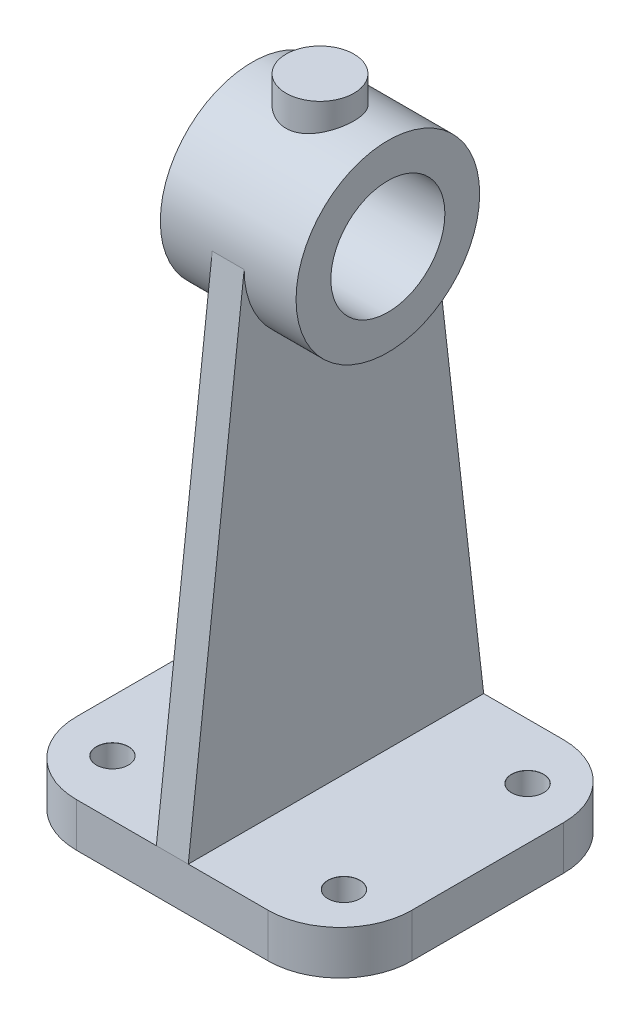
from build123d import *

# Parameters (mm, degrees)
SKETCH2_W                          = 84
SKETCH2_H                          = 74
BOSS_EXTRUDE1_DEPTH                = 11
FILLET1_R                          = 18
F_8_0_8_DIAMETER_HOLE1_D           = 8
F_8_0_8_DIAMETER_HOLE1_CSINK_D     = 8.05
F_8_0_8_DIAMETER_HOLE1_CSINK_ANGLE = 90
BOSS_EXTRUDE6_DEPTH                = 4
BOSS_EXTRUDE7_DEPTH                = 17
F_8_0_28_57_DIAMETER_HOLE1_D       = 28.57
BOSS_EXTRUDE8_REACH                = 173.397
SKETCH18_R                         = 8.5


with BuildPart() as part:
    # Sketch2 → Boss-Extrude1 (new body)
    with BuildSketch(Plane(origin=(0, 0, 0), x_dir=(1, 0, 0), z_dir=(0, 1, 0))):
        Rectangle(SKETCH2_W, SKETCH2_H)
    extrude(amount=BOSS_EXTRUDE1_DEPTH)

    # Fillet1
    fillet1_edges = [part.edges().sort_by_distance(p)[0] for p in [
        (-42, 5.5, -37),
        (42, 5.5, -37),
        (42, 5.5, 37),
        (-42, 5.5, 37),
    ]]
    fillet(fillet1_edges, radius=FILLET1_R)

    # Ø8.0 (8) Diameter Hole1 (through all)
    with Locations(Plane(origin=(0, 11, 0), x_dir=(1, 0, 0), z_dir=(0, 1, 0))):
        with Locations((-29, 23), (29, 23), (29, -23), (-29, -23)):
            CounterSinkHole(F_8_0_8_DIAMETER_HOLE1_D / 2, F_8_0_8_DIAMETER_HOLE1_CSINK_D / 2, counter_sink_angle=F_8_0_8_DIAMETER_HOLE1_CSINK_ANGLE)

    # Sketch9 → Boss-Extrude6 (add, symmetric)
    with BuildSketch(Plane(origin=(0, 0, 0), x_dir=(0, 0, -1), z_dir=(1, 0, 0))):
        with BuildLine():
            Line((-23, 133), (-37, 11))
            Line((-37, 11), (37, 11))
            Line((37, 11), (23, 133))
            ThreePointArc((23, 133), (0, 110), (-23, 133))
        make_face()
    extrude(amount=BOSS_EXTRUDE6_DEPTH, both=True)

    # Sketch9<9> → Boss-Extrude7 (add, symmetric)
    with BuildSketch(Plane(origin=(0, 0, 0), x_dir=(0, 0, -1), z_dir=(1, 0, 0))):
        with BuildLine():
            ThreePointArc((23, 133), (0, 156), (-23, 133))
            ThreePointArc((-23, 133), (0, 110), (23, 133))
        make_face()
    extrude(amount=BOSS_EXTRUDE7_DEPTH, both=True)

    # Ø8.0 (28.57) Diameter Hole1 (through all)
    with Locations(Plane(origin=(17, 0, 0), x_dir=(0, 0, -1), z_dir=(1, 0, 0))):
        with Locations((0, 133)):
            Hole(F_8_0_28_57_DIAMETER_HOLE1_D / 2)

    # Sketch18 → Boss-Extrude8 (add, up to next)
    with BuildSketch(Plane(origin=(0, 162, 0), x_dir=(-1, 0, 0), z_dir=(0, -1, 0)), mode=Mode.PRIVATE) as boss_extrude8_sk1:
        Circle(SKETCH18_R)
    boss_extrude8_tool1 = extrude(boss_extrude8_sk1.sketch, amount=BOSS_EXTRUDE8_REACH, mode=Mode.PRIVATE) - part.part
    add(boss_extrude8_tool1.solids().sort_by_distance((0, 162, 0))[0])


solid = part.part
